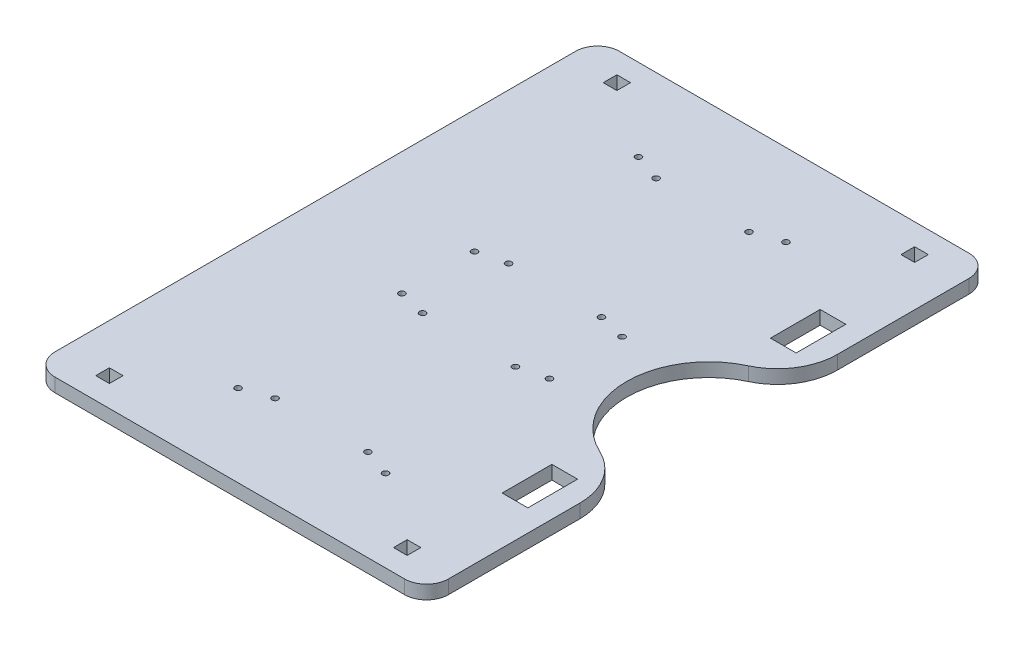
from build123d import *

# Parameters (mm, degrees)
SKETCH3_R           = 1.4224
SKETCH3_W           = 6.35
SKETCH3_H           = 6.35
SKETCH3_W_2         = 11.938
SKETCH3_H_2         = 23.114
BOSS_EXTRUDE1_DEPTH = 6.35
FILLET1_R           = 10.16
FILLET2_R           = 27.94


with BuildPart() as part:
    # Sketch3 → Boss-Extrude1 (new body)
    with BuildSketch(Plane(origin=(0, 0, 0), x_dir=(1, 0, 0), z_dir=(0, 1, 0))):
        with BuildLine():
            Line((182.88, 0), (0, 0))
            Line((0, 0), (0, 262.339276313))
            Line((0, 262.339276313), (182.88, 262.339276313))
            Line((182.88, 262.339276313), (182.88, 169.269638157))
            ThreePointArc((182.88, 169.269638157), (144.78, 131.169638157), (182.88, 93.069638157))
            Line((182.88, 93.069638157), (182.88, 0))
        make_face()
        with Locations(Location((57.15, 38.1, 0), (0, 0, 270))):
            Circle(SKETCH3_R, mode=Mode.SUBTRACT)
        with Locations(Location((57.15, 114.3, 0), (0, 0, 270))):
            Circle(SKETCH3_R, mode=Mode.SUBTRACT)
        with Locations(Location((125.73, 114.3, 0), (0, 0, 90))):
            Circle(SKETCH3_R, mode=Mode.SUBTRACT)
        with Locations(Location((125.73, 38.1, 0), (0, 0, 90))):
            Circle(SKETCH3_R, mode=Mode.SUBTRACT)
        with Locations(Location((69.85, 151.157668748, 0), (0, 0, 270))):
            Circle(SKETCH3_R, mode=Mode.SUBTRACT)
        with Locations(Location((69.85, 219.737668748, 0), (0, 0, 270))):
            Circle(SKETCH3_R, mode=Mode.SUBTRACT)
        with Locations(Location((113.03, 151.157668748, 0), (0, 0, 90))):
            Circle(SKETCH3_R, mode=Mode.SUBTRACT)
        with Locations(Location((113.03, 219.737668748, 0), (0, 0, 90))):
            Circle(SKETCH3_R, mode=Mode.SUBTRACT)
        with Locations(Location((113.03, 42.601607565, 0), (0, 0, 270))):
            Circle(SKETCH3_R, mode=Mode.SUBTRACT)
        with Locations(Location((113.03, 111.181607565, 0), (0, 0, 270))):
            Circle(SKETCH3_R, mode=Mode.SUBTRACT)
        with Locations(Location((69.85, 111.181607565, 0), (0, 0, 90))):
            Circle(SKETCH3_R, mode=Mode.SUBTRACT)
        with Locations(Location((69.85, 42.601607565, 0), (0, 0, 90))):
            Circle(SKETCH3_R, mode=Mode.SUBTRACT)
        with Locations(Location((125.73, 148.039276313, 0), (0, 0, 270))):
            Circle(SKETCH3_R, mode=Mode.SUBTRACT)
        with Locations(Location((125.73, 224.239276313, 0), (0, 0, 270))):
            Circle(SKETCH3_R, mode=Mode.SUBTRACT)
        with Locations(Location((57.15, 224.239276313, 0), (0, 0, 90))):
            Circle(SKETCH3_R, mode=Mode.SUBTRACT)
        with Locations(Location((57.15, 148.039276313, 0), (0, 0, 90))):
            Circle(SKETCH3_R, mode=Mode.SUBTRACT)
        with Locations((22.225, 13.212735966)):
            Rectangle(SKETCH3_W, SKETCH3_H, mode=Mode.SUBTRACT)
        with Locations((160.655, 13.212735966)):
            Rectangle(SKETCH3_W, SKETCH3_H, mode=Mode.SUBTRACT)
        with Locations((160.655, 249.126540348)):
            Rectangle(SKETCH3_W, SKETCH3_H, mode=Mode.SUBTRACT)
        with Locations((22.225, 249.126540348)):
            Rectangle(SKETCH3_W, SKETCH3_H, mode=Mode.SUBTRACT)
        with Locations((166.751, 193.526638157)):
            Rectangle(SKETCH3_W_2, SKETCH3_H_2, mode=Mode.SUBTRACT)
        with Locations((166.751, 68.812638157)):
            Rectangle(SKETCH3_W_2, SKETCH3_H_2, mode=Mode.SUBTRACT)
    extrude(amount=BOSS_EXTRUDE1_DEPTH)

    # Fillet1
    fillet1_edges = [part.edges().sort_by_distance(p)[0] for p in [
        (0, 3.175, -262.339276313),
        (182.88, 3.175, -262.339276313),
        (182.88, 3.175, 0),
        (0, 3.175, 0),
    ]]
    fillet(fillet1_edges, radius=FILLET1_R)

    # Fillet2
    fillet2_edges = [part.edges().sort_by_distance(p)[0] for p in [
        (182.88, 3.175, -169.269638157),
        (182.88, 3.175, -93.069638157),
    ]]
    fillet(fillet2_edges, radius=FILLET2_R)


solid = part.part
